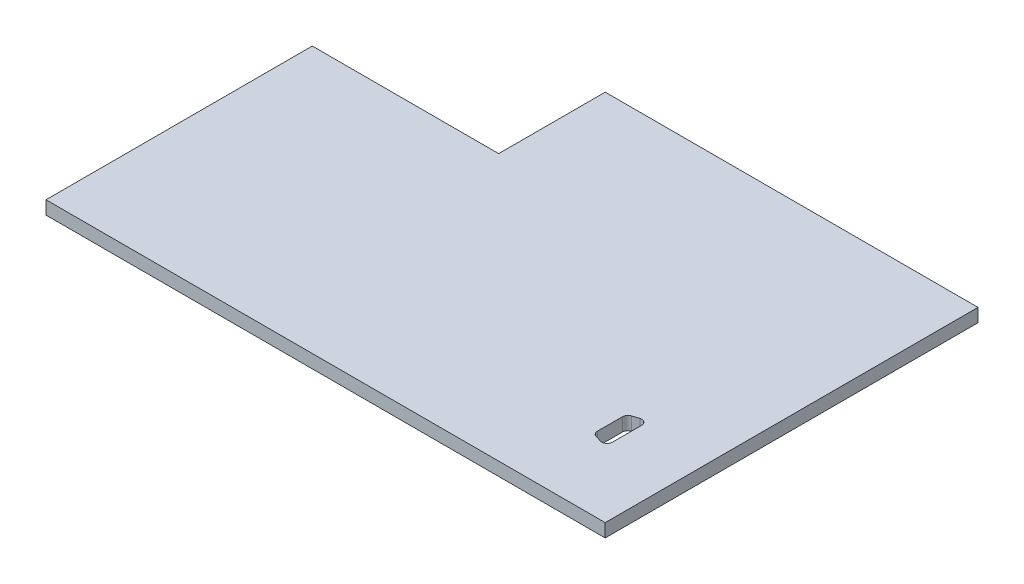
from build123d import *

# Parameters (mm, degrees)
BOSS_EXTRUDE1_DEPTH = 6.35
BOSS_EXTRUDE2_DEPTH = 11.43
CUT_EXTRUDE1_DEPTH  = 12.7
FILLET1_R           = 2.54


with BuildPart() as part:
    # Sketch1 → Boss-Extrude1 (new body)
    with BuildSketch(Plane(origin=(0, 0, 0), x_dir=(1, 0, 0), z_dir=(0, 1, 0))):
        Polygon((0, 0), (0, 127), (88.9, 127), (88.9, 177.8), (266.7, 177.8), (266.7, 0), align=None)
    extrude(amount=BOSS_EXTRUDE1_DEPTH)

    # Sketch2 → Boss-Extrude2 (add)
    with BuildSketch(Plane(origin=(0, 6.35, 0), x_dir=(1, 0, 0), z_dir=(0, 1, 0))):
        Polygon((19.05, 114.3), (101.6, 114.3), (101.6, 158.75), (88.9, 158.75), (88.9, 127), (19.05, 127), align=None)
    extrude(amount=-BOSS_EXTRUDE2_DEPTH)

    # Sketch3 → Cut-Extrude1 (cut)
    with BuildSketch(Plane(origin=(0, 6.35, 0), x_dir=(1, 0, 0), z_dir=(0, 1, 0))):
        Polygon((235.204, 31.496), (235.204, 52.324), (227.076, 49.784), (227.076, 34.036), align=None)
    extrude(amount=-CUT_EXTRUDE1_DEPTH, mode=Mode.SUBTRACT)

    # Fillet1
    fillet1_edges = [part.edges().sort_by_distance(p)[0] for p in [
        (235.204, 3.175, -31.496),
        (227.076, 3.175, -34.036),
        (227.076, 3.175, -49.784),
        (235.204, 3.175, -52.324),
    ]]
    fillet(fillet1_edges, radius=FILLET1_R)


solid = part.part
